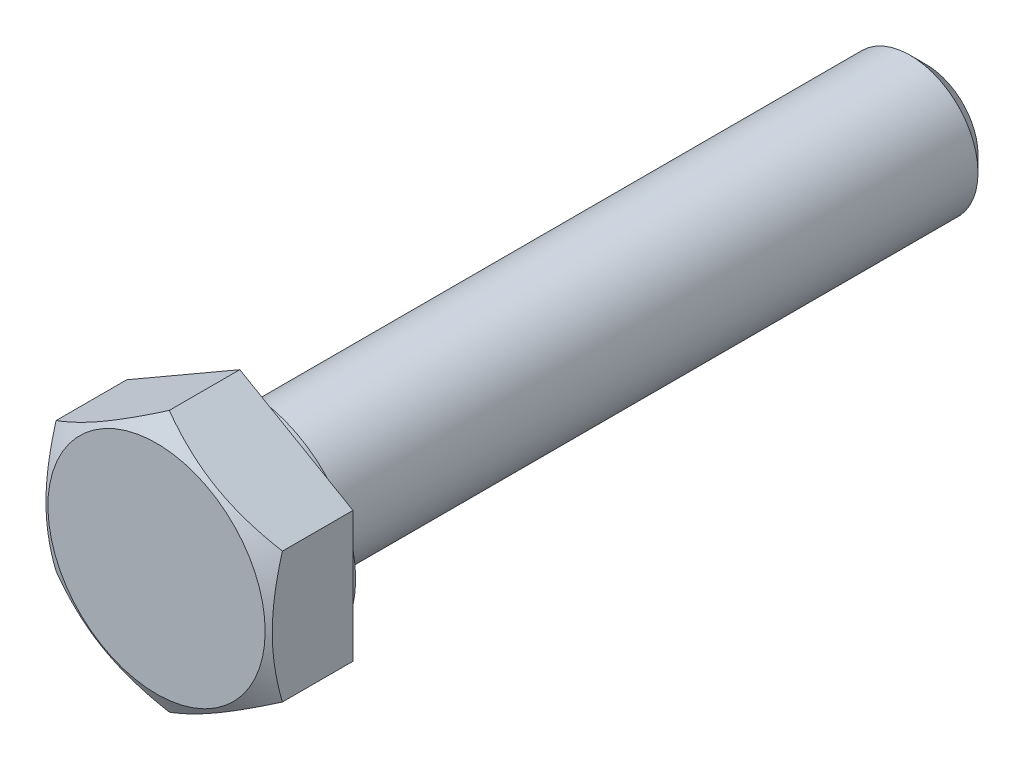
from build123d import *

# Parameters (mm, degrees)
SKETCH4_OUTSIDE_W  = 21.092
SKETCH4_OUTSIDE_H  = 21.092
CUT_EXTRUDE1_DEPTH = 35.966650779


with BuildPart() as part:
    # Sketch3 → Revolve1 (revolve)
    with BuildSketch(Plane(origin=(0, 0, 0), x_dir=(0, 0, -1), z_dir=(1, 0, 0))):
        Polygon((-17, 0), (-17, 4.8), (-16.437947959, 5.773502692), (-13.32, 5.773502692), (-13.32, 4.8), (-13, 4.8), (-13, 3), (16.3, 3), (17, 2.3), (17, 0), align=None)
    revolve(axis=Axis((0, 0, 17), (0, 0, -1)))

    # Sketch4 outside → Cut-Extrude1 (cut, through all)
    with BuildSketch(Plane.XY.offset(17)):
        Rectangle(SKETCH4_OUTSIDE_W, SKETCH4_OUTSIDE_H)
        Polygon((5, 2.886751346), (0, 5.773502692), (-5, 2.886751346), (-5, -2.886751346), (0, -5.773502692), (5, -2.886751346), align=None, mode=Mode.SUBTRACT)
    extrude(amount=-CUT_EXTRUDE1_DEPTH, mode=Mode.SUBTRACT)


solid = part.part
